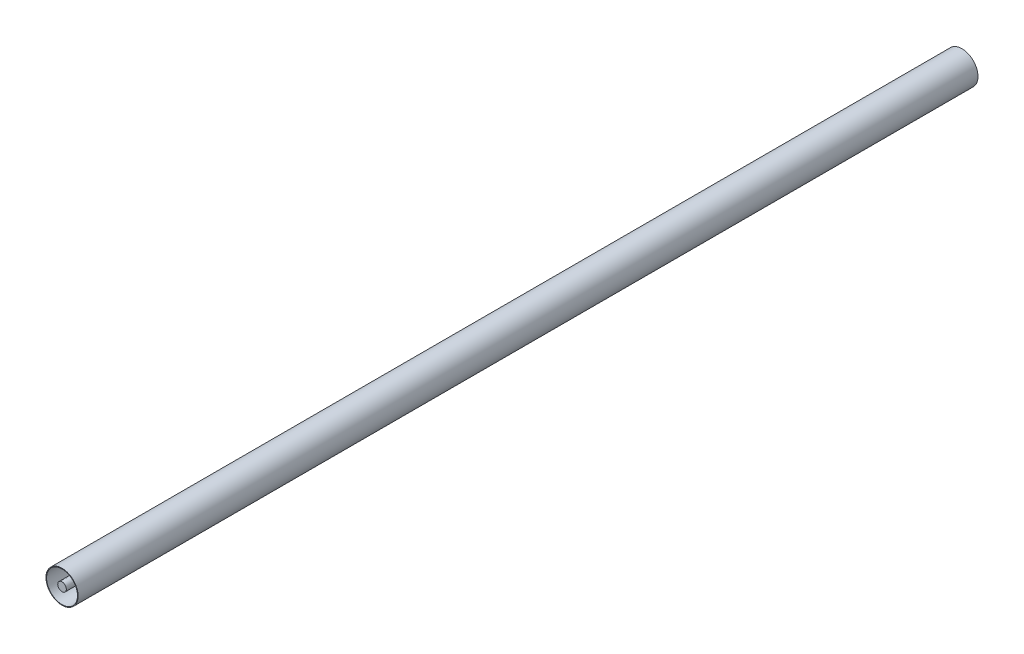
from build123d import *

# Parameters (mm, degrees)
SKETCH_1_R      = 4.772
EXTRUDE_1_DEPTH = 1000
SKETCH_2_R      = 17.84775552
SKETCH_2_R_2    = 17.1785
EXTRUDE_2_DEPTH = 1000


with BuildPart() as part:
    # Эскиз1 → Бобышка-Вытянуть1 (new body)
    with BuildSketch(Plane.XY):
        Circle(SKETCH_1_R)
    extrude(amount=EXTRUDE_1_DEPTH)


with BuildPart() as body_2:
    # Эскиз2 → Бобышка-Вытянуть2 (new body)
    with BuildSketch(Plane.XY.offset(1000)):
        Circle(SKETCH_2_R)
        Circle(SKETCH_2_R_2, mode=Mode.SUBTRACT)
    extrude(amount=-EXTRUDE_2_DEPTH)


solid = Compound([part.part, body_2.part])
